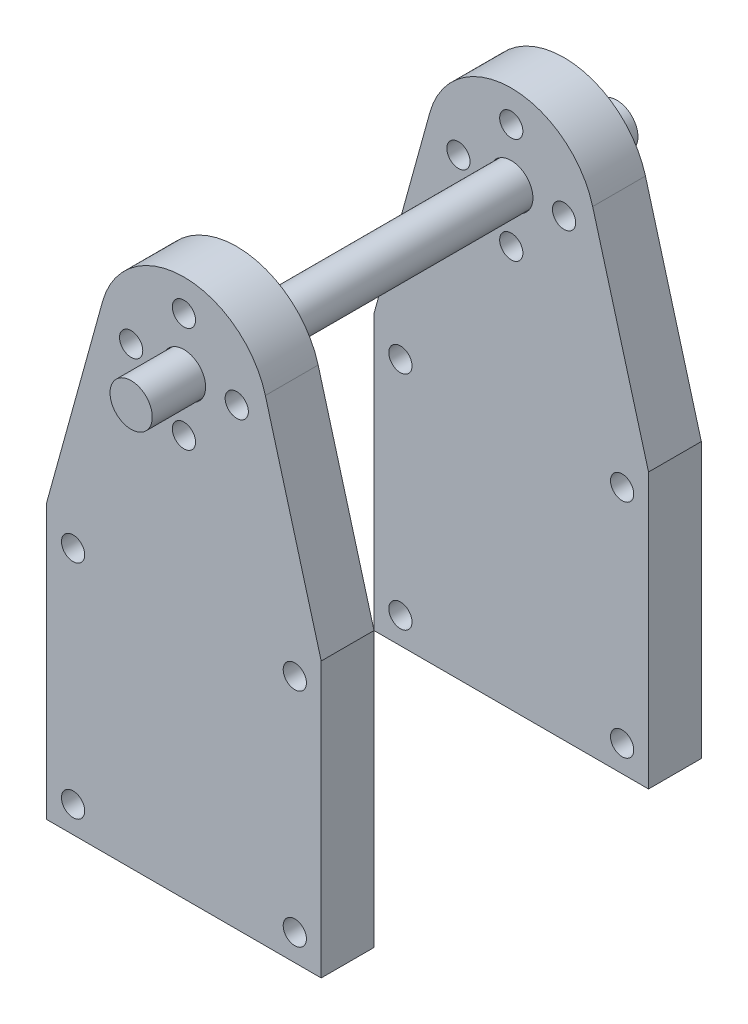
from build123d import *

# Parameters (mm, degrees)
SKETCH_1_R           = 1.1
SKETCH_1_R_2         = 2.05
EXTRUDE_1_DEPTH      = 5
SKETCH_4_R           = 1.1
SKETCH_4_R_2         = 2.05
EXTRUDE_2_DEPTH      = 5
EXTRUDE_3_DEPTH      = 5
EXTRUDE_3_DEPTH_BACK = 41
SKETCH_6_R           = 2


with BuildPart() as part:
    # ｽｹｯﾁ1 → ﾎﾞｽ - 押し出し1 (new body)
    with BuildSketch(Plane.XY):
        with BuildLine():
            Line((-13, -13), (13, -13))
            Line((13, -13), (13, 13))
            Line((13, 13), (7.710748735, 32.131749033))
            ThreePointArc((7.710748735, 32.131749033), (0, 38), (-7.710748735, 32.131749033))
            Line((-7.710748735, 32.131749033), (-13, 13))
            Line((-13, 13), (-13, -13))
        make_face()
        with Locations((-10.5, 10.5)):
            Circle(SKETCH_1_R, mode=Mode.SUBTRACT)
        with Locations((10.5, 10.5)):
            Circle(SKETCH_1_R, mode=Mode.SUBTRACT)
        with Locations((10.5, -10.5)):
            Circle(SKETCH_1_R, mode=Mode.SUBTRACT)
        with Locations((-10.5, -10.5)):
            Circle(SKETCH_1_R, mode=Mode.SUBTRACT)
        with Locations((0, 30)):
            Circle(SKETCH_1_R_2, mode=Mode.SUBTRACT)
        with Locations((0, 35)):
            Circle(SKETCH_1_R, mode=Mode.SUBTRACT)
        with Locations((5, 30)):
            Circle(SKETCH_1_R, mode=Mode.SUBTRACT)
        with Locations((0, 25)):
            Circle(SKETCH_1_R, mode=Mode.SUBTRACT)
        with Locations((-5, 30)):
            Circle(SKETCH_1_R, mode=Mode.SUBTRACT)
    extrude(amount=EXTRUDE_1_DEPTH)


with BuildPart() as body_2:
    # ｽｹｯﾁ4 → ﾎﾞｽ - 押し出し2 (new body)
    with BuildSketch(Plane.XY.offset(-26)):
        with BuildLine():
            Line((-13, 13), (-13, -13))
            Line((-13, -13), (13, -13))
            Line((13, -13), (13, 13))
            Line((13, 13), (7.710748735, 32.131749033))
            ThreePointArc((7.710748735, 32.131749033), (0, 38), (-7.710748735, 32.131749033))
            Line((-7.710748735, 32.131749033), (-13, 13))
        make_face()
        with Locations((-10.5, 10.5)):
            Circle(SKETCH_4_R, mode=Mode.SUBTRACT)
        with Locations((10.5, 10.5)):
            Circle(SKETCH_4_R, mode=Mode.SUBTRACT)
        with Locations((10.5, -10.5)):
            Circle(SKETCH_4_R, mode=Mode.SUBTRACT)
        with Locations((-10.5, -10.5)):
            Circle(SKETCH_4_R, mode=Mode.SUBTRACT)
        with Locations((0, 30)):
            Circle(SKETCH_4_R_2, mode=Mode.SUBTRACT)
        with Locations((0, 35)):
            Circle(SKETCH_4_R, mode=Mode.SUBTRACT)
        with Locations((5, 30)):
            Circle(SKETCH_4_R, mode=Mode.SUBTRACT)
        with Locations((0, 25)):
            Circle(SKETCH_4_R, mode=Mode.SUBTRACT)
        with Locations((-5, 30)):
            Circle(SKETCH_4_R, mode=Mode.SUBTRACT)
    extrude(amount=-EXTRUDE_2_DEPTH)


with BuildPart() as body_3:
    # ｽｹｯﾁ6 → ﾎﾞｽ - 押し出し3 (new, two sides: drawn at the far end of the back side and taken through both)
    with BuildSketch(Plane(origin=(0, 0, -31), x_dir=(-1, 0, 0), z_dir=(0, 0, -1)).offset(-EXTRUDE_3_DEPTH_BACK)):
        with Locations((0, 30)):
            Circle(SKETCH_6_R)
    extrude(amount=EXTRUDE_3_DEPTH + EXTRUDE_3_DEPTH_BACK)


solid = Compound([part.part, body_2.part, body_3.part])
